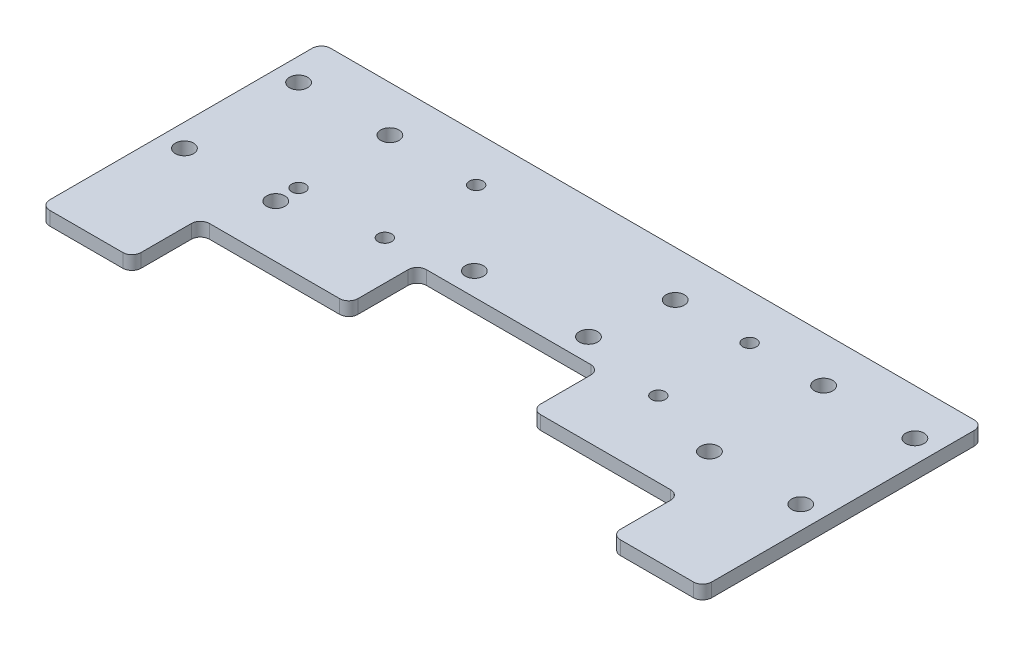
from build123d import *

# Parameters (mm, degrees)
SKETCH_1_W          = 145
SKETCH_1_H          = 61.5
SKETCH_1_R          = 2
EXTRUDE_1_DEPTH     = 3
SKETCH_2_R          = 2
CUT_EXTRUDE_1_DEPTH = 10
SKETCH_3_R          = 1.5
CUT_EXTRUDE_2_DEPTH = 10
FILLET_2_R          = 2


with BuildPart() as part:
    # 草图1 → 凸台-拉伸1 (new body)
    with BuildSketch(Plane(origin=(0, 0, 0), x_dir=(1, 0, 0), z_dir=(0, 1, 0))):
        with Locations((0, -8.25)):
            Rectangle(SKETCH_1_W, SKETCH_1_H)
        with Locations(Location((-67.5, 12.5, 0), (0, 0, 270))):
            Circle(SKETCH_1_R, mode=Mode.SUBTRACT)
        with Locations(Location((-67.5, -12.5, 0), (0, 0, 270))):
            Circle(SKETCH_1_R, mode=Mode.SUBTRACT)
        with Locations(Location((67.5, 12.5, 0), (0, 0, 270))):
            Circle(SKETCH_1_R, mode=Mode.SUBTRACT)
        with Locations(Location((67.5, -12.5, 0), (0, 0, 270))):
            Circle(SKETCH_1_R, mode=Mode.SUBTRACT)
        with Locations(Location((15, 12.5, 0), (0, 0, 270))):
            Circle(SKETCH_1_R, mode=Mode.SUBTRACT)
        with Locations(Location((15, -12.5, 0), (0, 0, 270))):
            Circle(SKETCH_1_R, mode=Mode.SUBTRACT)
        with Locations(Location((-47.5, 12.5, 0), (0, 0, 270))):
            Circle(SKETCH_1_R, mode=Mode.SUBTRACT)
        with Locations(Location((-47.5, -12.5, 0), (0, 0, 270))):
            Circle(SKETCH_1_R, mode=Mode.SUBTRACT)
        with Locations(Location((47.5, 12.5, 0), (0, 0, 270))):
            Circle(SKETCH_1_R, mode=Mode.SUBTRACT)
        with Locations(Location((47.5, -12.5, 0), (0, 0, 270))):
            Circle(SKETCH_1_R, mode=Mode.SUBTRACT)
    extrude(amount=EXTRUDE_1_DEPTH)

    # 草图2 → 切除-拉伸1 (cut)
    with BuildSketch(Plane(origin=(0, 3, 0), x_dir=(1, 0, 0), z_dir=(0, 1, 0))):
        with Locations(Location((-12.5, -4, 0), (0, 0, 270))):
            Circle(SKETCH_2_R)
        with Locations(Location((12.5, -4, 0), (0, 0, 270))):
            Circle(SKETCH_2_R)
        Polygon((-52.5, -39), (-52.5, -24), (-20, -24), (-20, -9), (20, -9), (20, -24), (52.5, -24), (52.5, -39), align=None)
    extrude(amount=-CUT_EXTRUDE_1_DEPTH, mode=Mode.SUBTRACT)

    # 草图3 → 切除-拉伸2 (cut)
    with BuildSketch(Plane(origin=(0, 3, 0), x_dir=(1, 0, 0), z_dir=(0, 1, 0))):
        with Locations((-47.5, 12.5)):
            Circle(SKETCH_3_R)
        with Locations(Location((-47.5, -7.5, 0), (0, 0, 270))):
            Circle(SKETCH_3_R)
        with Locations(Location((31.3, 12.5, 0), (0, 0, 270))):
            Circle(SKETCH_3_R)
        with Locations(Location((31.3, -7.5, 0), (0, 0, 270))):
            Circle(SKETCH_3_R)
        with Locations(Location((-28.6, 12.5, 0), (0, 0, 270))):
            Circle(SKETCH_3_R)
        with Locations(Location((-28.6, -7.5, 0), (0, 0, 270))):
            Circle(SKETCH_3_R)
    extrude(amount=-CUT_EXTRUDE_2_DEPTH, mode=Mode.SUBTRACT)

    # 圆角2
    fillet_2_edges = [part.edges().sort_by_distance(p)[0] for p in [
        (52.5, 1.5, 39),
        (-52.5, 1.5, 39),
        (-52.5, 1.5, 24),
        (-20, 1.5, 24),
        (-20, 1.5, 9),
        (20, 1.5, 9),
        (20, 1.5, 24),
        (52.5, 1.5, 24),
        (72.5, 1.5, -22.5),
        (72.5, 1.5, 39),
        (-72.5, 1.5, 39),
        (-72.5, 1.5, -22.5),
    ]]
    fillet(fillet_2_edges, radius=FILLET_2_R)


solid = part.part
